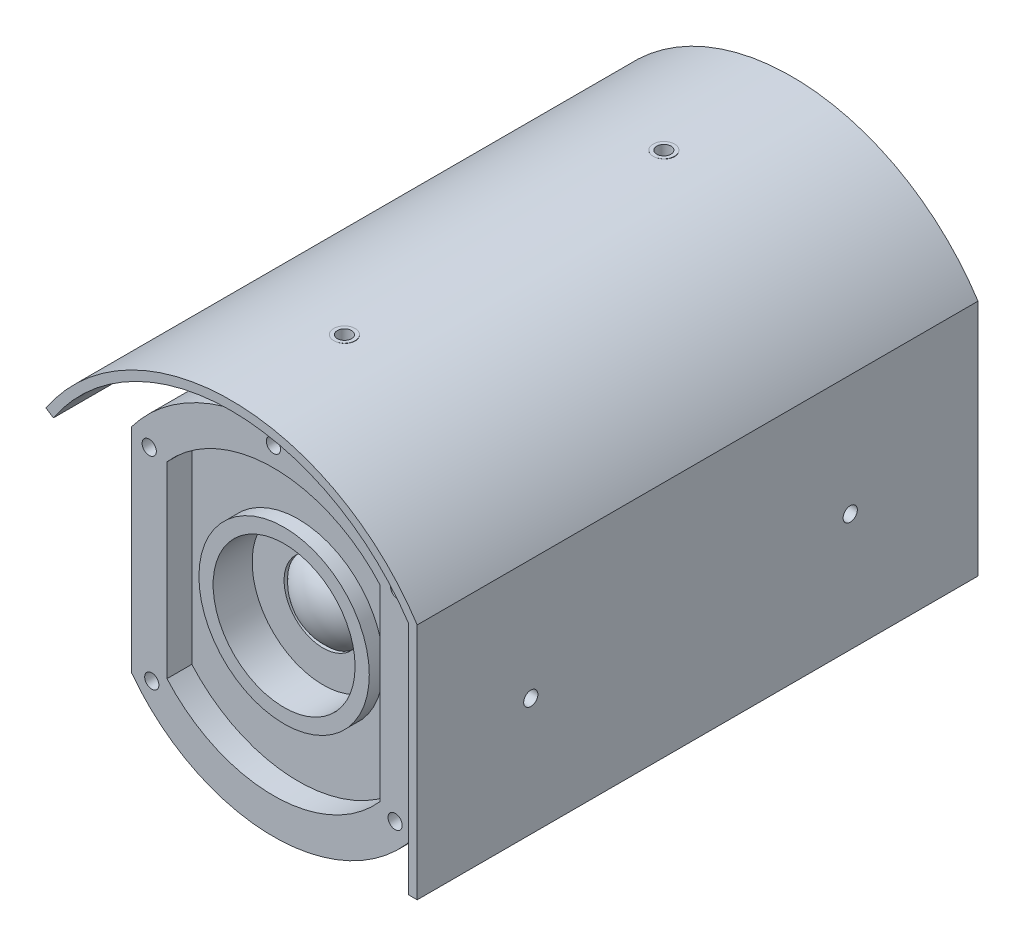
from build123d import *

# Parameters (mm, degrees)
BOSS_EXTRUDE1_DEPTH      = 140
CUT_EXTRUDE1_DEPTH       = 7
BOSS_EXTRUDE2_DEPTH      = 12
BOSS_EXTRUDE2_DEPTH_BACK = 146
SKETCH4_R                = 24
SKETCH4_R_2              = 20
BOSS_EXTRUDE3_DEPTH      = 4
CUT_EXTRUDE2_START       = -7
SKETCH5_R                = 20
CUT_EXTRUDE2_DEPTH       = 7
SKETCH6_R                = 11
CUT_EXTRUDE3_DEPTH       = 1
DOME1_FACE_RADIUS        = 11
DOME1_HEIGHT             = 5
SKETCH7_R                = 3
BOSS_EXTRUDE4_DEPTH      = 12.5
SKETCH8_R                = 2
CUT_EXTRUDE4_DEPTH       = 17
BOSS_EXTRUDE5_REACH      = 198.256
BOSS_EXTRUDE5_END_RADIUS = 50
SKETCH9_R                = 3
SKETCH10_R               = 2
CUT_EXTRUDE5_DEPTH       = 17
BOSS_EXTRUDE6_DEPTH      = 7
SKETCH12_W               = 70
SKETCH12_H               = 3.5
CUT_EXTRUDE6_DEPTH       = 5
SKETCH16_R               = 2
CUT_EXTRUDE8_DEPTH       = 5
L_EK1_SCALE              = 0.1


with BuildPart() as part:
    # Sketch1 → Boss-Extrude1 (new body)
    with BuildSketch(Plane.XY):
        with BuildLine():
            Line((-40, -30), (-40, 30))
            ThreePointArc((-40, 30), (0, 50), (40, 30))
            Line((40, 30), (40, -30))
            ThreePointArc((40, -30), (0, -50), (-40, -30))
        make_face()
    extrude(amount=BOSS_EXTRUDE1_DEPTH)

    # Sketch2 → Cut-Extrude1 (cut)
    with BuildSketch(Plane.XY.offset(140)):
        with BuildLine():
            Line((-30, 26.457513111), (-30, -26.457513111))
            ThreePointArc((-30, -26.457513111), (0, -40), (30, -26.457513111))
            Line((30, -26.457513111), (30, 26.457513111))
            ThreePointArc((30, 26.457513111), (0, 40), (-30, 26.457513111))
        make_face()
    extrude(amount=-CUT_EXTRUDE1_DEPTH, mode=Mode.SUBTRACT)

    # Sketch4 → Boss-Extrude3 (add)
    with BuildSketch(Plane.XY.offset(133)):
        Circle(SKETCH4_R)
        Circle(SKETCH4_R_2, mode=Mode.SUBTRACT)
    extrude(amount=BOSS_EXTRUDE3_DEPTH)

    # Sketch5 → Cut-Extrude2 (cut)
    with BuildSketch(Plane.XY.offset(133).offset(CUT_EXTRUDE2_START)):
        Circle(SKETCH5_R)
    extrude(amount=CUT_EXTRUDE2_DEPTH, mode=Mode.SUBTRACT)

    # Sketch6 → Cut-Extrude3 (cut)
    with BuildSketch(Plane.XY.offset(126)):
        Circle(SKETCH6_R)
    extrude(amount=-CUT_EXTRUDE3_DEPTH, mode=Mode.SUBTRACT)

    # Dome1: a dome of height H over a round flat face of radius A is a cap of a sphere of radius (A * A + H * H) / (2 * H)
    dome1_r = (DOME1_FACE_RADIUS * DOME1_FACE_RADIUS + DOME1_HEIGHT * DOME1_HEIGHT) / (2 * DOME1_HEIGHT)
    dome1_base = Plane((0, 0, 125), z_dir=(0, 0, 1))
    with Locations(dome1_base.offset(DOME1_HEIGHT - dome1_r)):
        dome1_ball = Sphere(dome1_r, mode=Mode.PRIVATE)
    add(split(dome1_ball, bisect_by=dome1_base, keep=Keep.TOP, mode=Mode.PRIVATE))



with BuildPart() as body_2:
    # Sketch3 → Boss-Extrude2 (new, two sides: drawn at the far end of the back side and taken through both)
    with BuildSketch(Plane.XY.offset(140).offset(-BOSS_EXTRUDE2_DEPTH_BACK)):
        with BuildLine():
            Line((52.5, -33.166247904), (52.5, 33.911649916))
            ThreePointArc((52.5, 33.911649916), (0.380386371, 62.498842439), (-52.083333333, 34.5481749))
            Line((-52.083333333, 34.5481749), (-50, 33.166247904))
            ThreePointArc((-50, 33.166247904), (0, 60), (50, 33.166247904))
            Line((50, 33.166247904), (50, -33.166247904))
            Line((50, -33.166247904), (52.5, -33.166247904))
        make_face()
    extrude(amount=BOSS_EXTRUDE2_DEPTH + BOSS_EXTRUDE2_DEPTH_BACK)


with BuildPart() as part_1:
    add(part.part)

    add(body_2.part)  # Boss-Extrude4 merges body 2
    # Sketch7 → Boss-Extrude4 (add)
    with BuildSketch(Plane(origin=(52.5, 0, 0), x_dir=(0, 0, -1), z_dir=(1, 0, 0))):
        with Locations(Location((-120, 0, 0), (0, 0, 270))):
            Circle(SKETCH7_R)
        with Locations(Location((-30, 0, 0), (0, 0, 270))):
            Circle(SKETCH7_R)
    extrude(amount=-BOSS_EXTRUDE4_DEPTH)

    # Sketch8 → Cut-Extrude4 (cut)
    with BuildSketch(Plane(origin=(52.5, 0, 0), x_dir=(0, 0, -1), z_dir=(1, 0, 0))):
        with Locations((-120, 0)):
            Circle(SKETCH8_R)
        with Locations((-30, 0)):
            Circle(SKETCH8_R)
    extrude(amount=-CUT_EXTRUDE4_DEPTH, mode=Mode.SUBTRACT)

    # Boss-Extrude5: up to this cylinder (the profile starts outside it)
    boss_extrude5_end = Plane(origin=(0, 0, 75), z_dir=(0, 0, -1)) * Cylinder(BOSS_EXTRUDE5_END_RADIUS, 587.512, mode=Mode.PRIVATE)
    # Sketch9 → Boss-Extrude5 (add, up to the surface)
    with BuildSketch(Plane(origin=(0, 62.5, 0), x_dir=(-1, 0, 0), z_dir=(0, 1, 0)), mode=Mode.PRIVATE) as boss_extrude5_sk1:
        with Locations(Location((0, 120, 0), (0, 0, 90))):
            Circle(SKETCH9_R)
    boss_extrude5_tool1 = extrude(boss_extrude5_sk1.sketch, amount=-BOSS_EXTRUDE5_REACH, mode=Mode.PRIVATE) - boss_extrude5_end
    add(boss_extrude5_tool1.solids().sort_by_distance((0, 62.5, 120))[0])
    # Sketch9 → Boss-Extrude5 (add, up to the surface)
    with BuildSketch(Plane(origin=(0, 62.5, 0), x_dir=(-1, 0, 0), z_dir=(0, 1, 0)), mode=Mode.PRIVATE) as boss_extrude5_sk2:
        with Locations(Location((0, 30, 0), (0, 0, 90))):
            Circle(SKETCH9_R)
    boss_extrude5_tool2 = extrude(boss_extrude5_sk2.sketch, amount=-BOSS_EXTRUDE5_REACH, mode=Mode.PRIVATE) - boss_extrude5_end
    add(boss_extrude5_tool2.solids().sort_by_distance((0, 62.5, 30))[0])

    # Sketch10 → Cut-Extrude5 (cut)
    with BuildSketch(Plane(origin=(0, 62.5, 0), x_dir=(1, 0, 0), z_dir=(0, 1, 0))):
        with Locations(Location((0, -30, 0), (0, 0, 270))):
            Circle(SKETCH10_R)
        with Locations(Location((0, -120, 0), (0, 0, 270))):
            Circle(SKETCH10_R)
    extrude(amount=-CUT_EXTRUDE5_DEPTH, mode=Mode.SUBTRACT)

    # Sketch11 → Boss-Extrude6 (add)
    with BuildSketch(Plane(origin=(0, 0, 0), x_dir=(-1, 0, 0), z_dir=(0, 0, -1))):
        with BuildLine():
            Line((-42, 30.659419434), (-42, -30.659419434))
            ThreePointArc((-42, -30.659419434), (0, -52), (42, -30.659419434))
            Line((42, -30.659419434), (42, 30.659419434))
            ThreePointArc((42, 30.659419434), (0, 52), (-42, 30.659419434))
        make_face()
        with BuildLine():
            Line((-40, 30), (-40, -30))
            ThreePointArc((-40, -30), (0, -50), (40, -30))
            Line((40, -30), (40, 30))
            ThreePointArc((40, 30), (0, 50), (-40, 30))
        make_face(mode=Mode.SUBTRACT)
    extrude(amount=-BOSS_EXTRUDE6_DEPTH)

    # Sketch12 → Cut-Extrude6 (cut)
    with BuildSketch(Plane(origin=(0, 0, 0), x_dir=(-1, 0, 0), z_dir=(0, 0, -1))):
        with BuildLine():
            ThreePointArc((16.155494421, 42), (0, 45), (-16.155494421, 42))
            Line((-16.155494421, 42), (16.155494421, 42))
        make_face()
        with BuildLine():
            ThreePointArc((-21.558061137, 39.5), (-24.342017693, 37.84793488), (-27, 36))
            Line((-27, 36), (27, 36))
            ThreePointArc((27, 36), (24.342017693, 37.84793488), (21.558061137, 39.5))
            Line((21.558061137, 39.5), (-21.558061137, 39.5))
        make_face()
        with BuildLine():
            ThreePointArc((-30.045798375, 33.5), (-31.841535092, 31.798060365), (-33.541019662, 30))
            Line((-33.541019662, 30), (33.541019662, 30))
            ThreePointArc((33.541019662, 30), (31.841535092, 31.798060365), (30.045798375, 33.5))
            Line((30.045798375, 33.5), (-30.045798375, 33.5))
        make_face()
        with Locations((0, 25.75)):
            Rectangle(SKETCH12_W, SKETCH12_H)
        with Locations((0, 19.75)):
            Rectangle(SKETCH12_W, SKETCH12_H)
        with Locations((0, 13.75)):
            Rectangle(SKETCH12_W, SKETCH12_H)
        with Locations((0, 7.75)):
            Rectangle(SKETCH12_W, SKETCH12_H)
        with Locations((0, 1.75)):
            Rectangle(SKETCH12_W, SKETCH12_H)
        with Locations((0, -4.25)):
            Rectangle(SKETCH12_W, SKETCH12_H)
        with Locations((0, -10.25)):
            Rectangle(SKETCH12_W, SKETCH12_H)
        with Locations((0, -16.25)):
            Rectangle(SKETCH12_W, SKETCH12_H)
        with Locations((0, -22.25)):
            Rectangle(SKETCH12_W, SKETCH12_H)
        with BuildLine():
            Line((35, -26.5), (-35, -26.5))
            Line((-35, -26.5), (-35, -28.284271247))
            ThreePointArc((-35, -28.284271247), (-34.281245243, -29.151264546), (-33.541019662, -30))
            Line((-33.541019662, -30), (33.541019662, -30))
            ThreePointArc((33.541019662, -30), (34.281245243, -29.151264546), (35, -28.284271247))
            Line((35, -28.284271247), (35, -26.5))
        make_face()
        with BuildLine():
            Line((31.124748995, -32.5), (-31.124748995, -32.5))
            ThreePointArc((-31.124748995, -32.5), (-29.115015223, -34.31203708), (-27, -36))
            Line((-27, -36), (27, -36))
            ThreePointArc((27, -36), (29.115015223, -34.31203708), (31.124748995, -32.5))
        make_face()
        with BuildLine():
            Line((23.296995514, -38.5), (-23.296995514, -38.5))
            ThreePointArc((-23.296995514, -38.5), (-19.803717846, -40.408077899), (-16.155494421, -42))
            Line((-16.155494421, -42), (16.155494421, -42))
            ThreePointArc((16.155494421, -42), (19.803717846, -40.408077899), (23.296995514, -38.5))
        make_face()
    extrude(amount=-CUT_EXTRUDE6_DEPTH, mode=Mode.SUBTRACT)

    # Sketch16 → Cut-Extrude8 (cut)
    with BuildSketch(Plane.XY.offset(140)):
        with Locations((35, 27.5)):
            Circle(SKETCH16_R)
        with Locations((-35, 27.5)):
            Circle(SKETCH16_R)
        with Locations((0, 45.5)):
            Circle(SKETCH16_R)
        with Locations((34.281245243, -29.151264546)):
            Circle(SKETCH16_R)
        with Locations((-34.281245243, -29.151264546)):
            Circle(SKETCH16_R)
    extrude(amount=-CUT_EXTRUDE8_DEPTH, mode=Mode.SUBTRACT)


with BuildPart() as part_2:
    # Ölçek1: scaled about (1.34960215, 2.45414882, 68.679002024)
    add(part_1.part.scale(L_EK1_SCALE).moved(Location((1.214641935, 2.208733938, 61.811101822))))


solid = part_2.part
